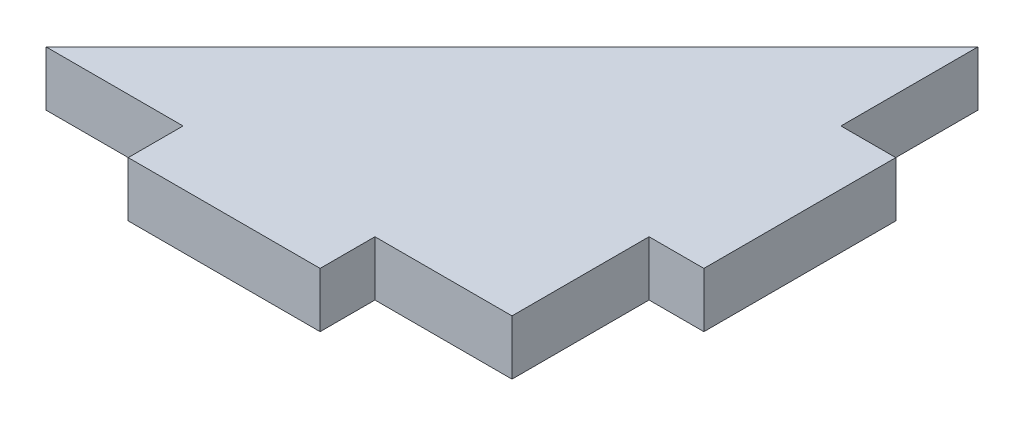
from build123d import *

# Parameters (mm, degrees)
SKETCH1_W           = 7
SKETCH1_H           = 2
SKETCH1_W_2         = 2
SKETCH1_H_2         = 7
BOSS_EXTRUDE1_DEPTH = 2


with BuildPart() as part:
    # Sketch1 → Boss-Extrude1 (new body)
    with BuildSketch(Plane(origin=(0, 0, 0), x_dir=(1, 0, 0), z_dir=(0, 1, 0))):
        Polygon((0, 17), (0, 0), (-17, 0), align=None)
        with Locations((-8.5, -1)):
            Rectangle(SKETCH1_W, SKETCH1_H)
        with Locations((1, 8.5)):
            Rectangle(SKETCH1_W_2, SKETCH1_H_2)
    extrude(amount=BOSS_EXTRUDE1_DEPTH)


solid = part.part
